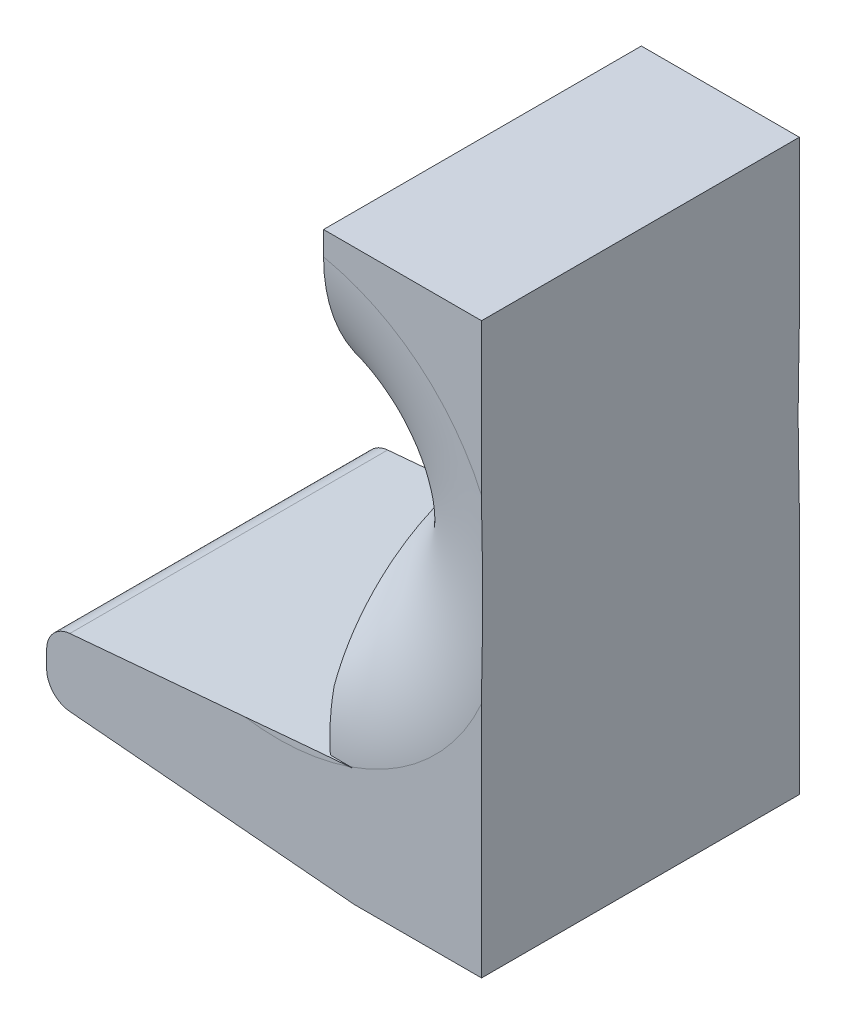
from build123d import *

# Parameters (mm, degrees)
BOSS_EXTRUDE1_DEPTH = 12.5
BOSS_EXTRUDE2_DEPTH = 2.429285786
FILLET2_R           = 2


with BuildPart() as part:
    # Sketch2 → Boss-Extrude1 (new, symmetric)
    with BuildSketch(Plane.XY):
        Polygon((33.927983868, -28.997706932), (33.927983868, -52.497706932), (36.357269654, -52.497706932), (36.357269654, -64.539943653), (12.14546184, -66.65820236), (12.14546184, -71.65820236), (36.357269654, -73.776461068), (46.357269654, -73.776461068), (46.357269654, -28.997706932), align=None)
    extrude(amount=BOSS_EXTRUDE1_DEPTH, both=True)

    # Sketch4 → Boss-Extrude2 (add)
    with BuildSketch(Plane.ZY.offset(-36.357269654)):
        with BuildLine():
            Line((-12.5, -52.497706932), (-12.5, -64.539943653))
            Line((-12.5, -64.539943653), (-12.491615299, -64.539943653))
            ThreePointArc((-12.491615299, -64.539943653), (-8.675481514, -55.998483605), (0, -52.497706932))
            Line((0, -52.497706932), (-12.5, -52.497706932))
        make_face()
        with BuildLine():
            Line((12.5, -52.497706932), (0, -52.497706932))
            ThreePointArc((0, -52.497706932), (8.675481514, -55.998483605), (12.491615299, -64.539943653))
            Line((12.491615299, -64.539943653), (12.5, -64.539943653))
            Line((12.5, -64.539943653), (12.5, -52.497706932))
        make_face()
    extrude(amount=BOSS_EXTRUDE2_DEPTH)

    # Sketch3 → Cut-Revolve1 (revolve, cut)
    with BuildSketch(Plane.ZY.offset(-30.357269654)):
        with BuildLine():
            Line((-12.5, -47.997706932), (12.5, -47.997706932))
            Line((12.5, -47.997706932), (12.5, -30.497706932))
            ThreePointArc((12.5, -30.497706932), (0, -42.997706932), (-12.5, -30.497706932))
            Line((-12.5, -30.497706932), (-12.5, -47.997706932))
        make_face()
    revolve(axis=Axis((30.357269654, -47.997706932, -12.5), (0, 0, 1)), mode=Mode.SUBTRACT)

    # Fillet2
    fillet2_edges = [part.edges().sort_by_distance(p)[0] for p in [
        (12.14546184, -71.65820236, 0),
        (12.14546184, -66.65820236, 0),
    ]]
    fillet(fillet2_edges, radius=FILLET2_R)


solid = part.part
